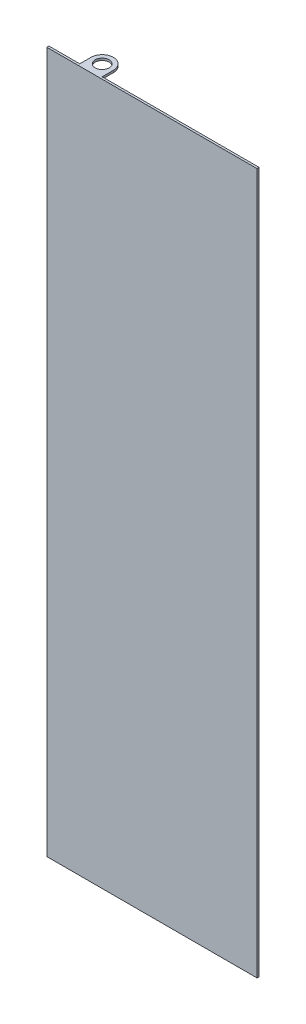
from build123d import *

# Parameters (mm, degrees)
SKETCH2_W           = 150
SKETCH2_H           = 500
BOSS_EXTRUDE1_DEPTH = 1.5
SKETCH3_R           = 5
BOSS_EXTRUDE2_DEPTH = 1.5


with BuildPart() as part:
    # Sketch2 → Boss-Extrude1 (new body)
    with BuildSketch(Plane.XY):
        Rectangle(SKETCH2_W, SKETCH2_H)
    extrude(amount=BOSS_EXTRUDE1_DEPTH)

    # Sketch3 → Boss-Extrude2 (add)
    with BuildSketch(Plane(origin=(0, 250, 0), x_dir=(1, 0, 0), z_dir=(0, 1, 0))):
        with BuildLine():
            Line((-53, 0), (-53, 8))
            ThreePointArc((-53, 8), (-45, 16), (-37, 8))
            Line((-37, 8), (-37, 0))
            Line((-37, 0), (-53, 0))
        make_face()
        with Locations(Location((-45, 8, 0), (0, 0, 270))):
            Circle(SKETCH3_R, mode=Mode.SUBTRACT)
    extrude(amount=-BOSS_EXTRUDE2_DEPTH)


solid = part.part
